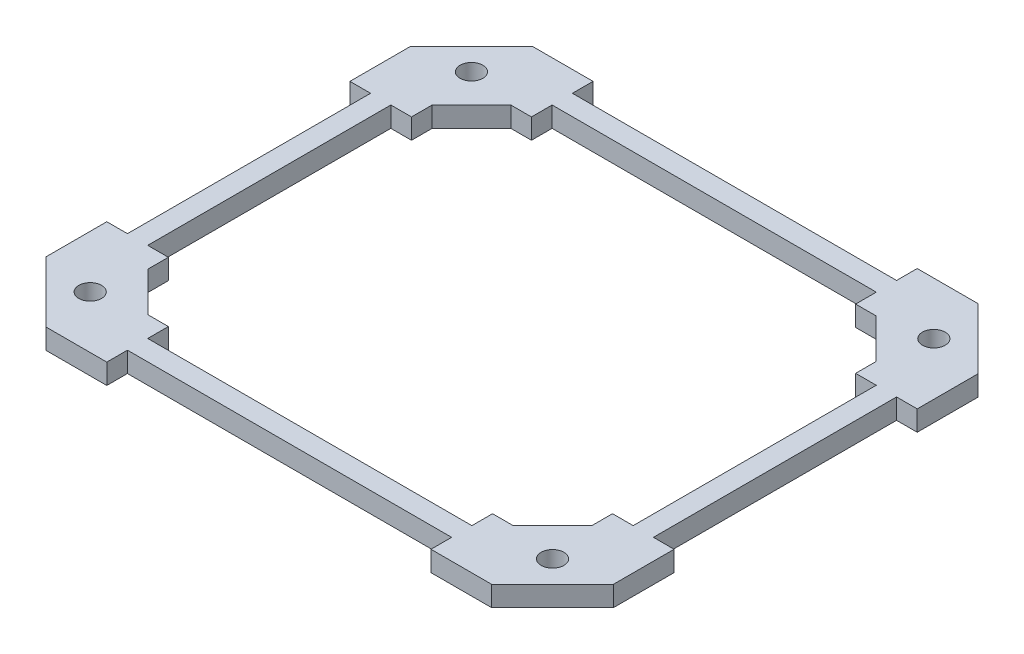
from build123d import *

# Parameters (mm, degrees)
BOSS_EXTRUDE1_DEPTH     = 6.35
F_1_4_CLEARANCE_HOLE1_D = 7.14248


with BuildPart() as part:
    # Sketch1 → Boss-Extrude1 (new body)
    with BuildSketch(Plane(origin=(0, 0, 0), x_dir=(1, 0, 0), z_dir=(0, 1, 0))):
        Polygon((-88.9, -38.1), (-88.9, -57.15), (-69.85, -76.2), (-50.8, -76.2), (-50.8, -69.723), (50.8, -69.723), (50.8, -76.2), (69.85, -76.2), (88.9, -57.15), (88.9, -38.1), (82.423, -38.1), (82.423, 38.1), (88.9, 38.1), (88.9, 57.15), (69.85, 76.2), (50.8, 76.2), (50.8, 69.723), (-50.8, 69.723), (-50.8, 76.2), (-69.85, 76.2), (-88.9, 57.15), (-88.9, 38.1), (-82.423, 38.1), (-82.423, -38.1), align=None)
        Polygon((-57.15, -56.896), (-69.596, -44.45), (-69.596, -38.1), (-76.073, -38.1), (-76.073, 38.1), (-69.596, 38.1), (-69.596, 44.45), (-57.15, 56.896), (-50.8, 56.896), (-50.8, 63.373), (50.8, 63.373), (50.8, 56.896), (57.15, 56.896), (69.596, 44.45), (69.596, 38.1), (76.073, 38.1), (76.073, -38.1), (69.596, -38.1), (69.596, -44.45), (57.15, -56.896), (50.8, -56.896), (50.8, -63.373), (-50.8, -63.373), (-50.8, -56.896), align=None, mode=Mode.SUBTRACT)
    extrude(amount=BOSS_EXTRUDE1_DEPTH)

    # 1/4 Clearance Hole1 (through all)
    with Locations(Plane(origin=(0, 0, 0), x_dir=(-1, 0, 0), z_dir=(0, -1, 0))):
        with Locations((-72.452653333, 59.752653333), (72.452653333, 59.752653333), (72.452653333, -59.752653333), (-72.452653333, -59.752653333)):
            Hole(F_1_4_CLEARANCE_HOLE1_D / 2)


solid = part.part
